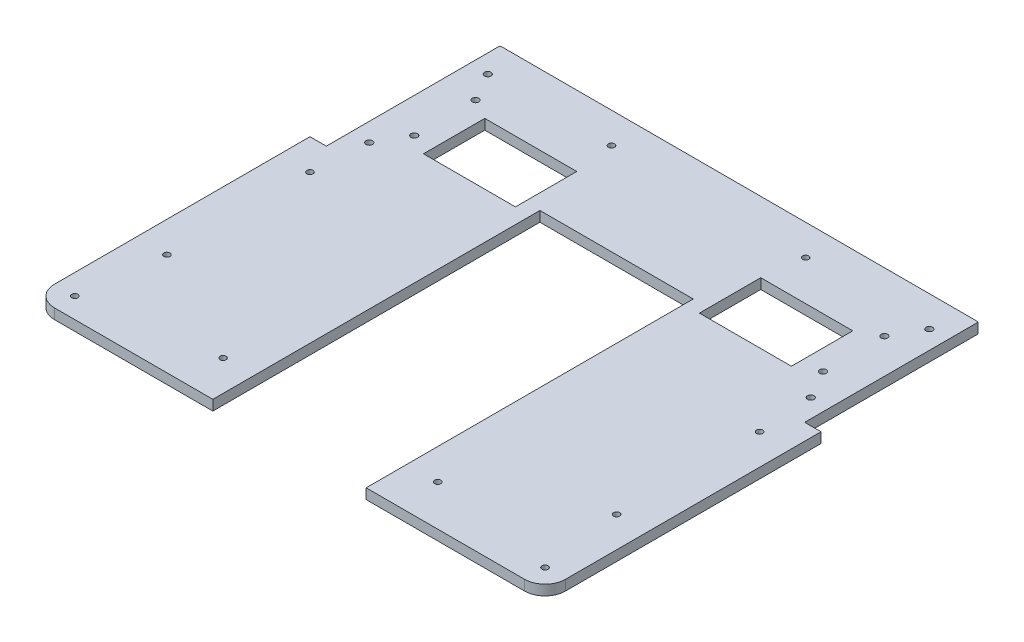
from build123d import *

# Parameters (mm, degrees)
EXTRUDE_1_DEPTH      = 5
SKETCH_4_W           = 45
SKETCH_4_H           = 30
CUT_EXTRUDE_3_DEPTH  = 5
SKETCH_5_W           = 75
SKETCH_5_H           = 160
CUT_EXTRUDE_4_DEPTH  = 5
CUT_EXTRUDE_5_REACH  = 335.054
SKETCH_6_R           = 1.5
CUT_EXTRUDE_7_REACH  = 335.054
SKETCH_7_R           = 1.6
CUT_EXTRUDE_8_REACH  = 335.054
SKETCH_8_R           = 1.5
CUT_EXTRUDE_9_REACH  = 335.054
SKETCH_9_R           = 1.5
CUT_EXTRUDE_10_REACH = 335.054
SKETCH_10_W          = 8
SKETCH_10_H          = 85


with BuildPart() as part:
    # 草图1 → 凸台-拉伸1 (new body)
    with BuildSketch(Plane(origin=(0, 0, 0), x_dir=(1, 0, 0), z_dir=(0, 1, 0))):
        with BuildLine():
            Line((10, 0), (240, 0))
            ThreePointArc((240, 0), (247.071067812, -2.928932188), (250, -10))
            Line((250, -10), (250, -210))
            ThreePointArc((250, -210), (247.071067812, -217.071067812), (240, -220))
            Line((240, -220), (10, -220))
            ThreePointArc((10, -220), (2.928932188, -217.071067812), (0, -210))
            Line((0, -210), (0, -10))
            ThreePointArc((0, -10), (2.928932188, -2.928932188), (10, 0))
        make_face()
    extrude(amount=EXTRUDE_1_DEPTH)

    # 草图4 → 切除-拉伸3 (cut)
    with BuildSketch(Plane.XZ):
        with Locations((192.5, 49.475)):
            Rectangle(SKETCH_4_W, SKETCH_4_H)
        with Locations((57.5, 49.475)):
            Rectangle(SKETCH_4_W, SKETCH_4_H)
    extrude(amount=-CUT_EXTRUDE_3_DEPTH, mode=Mode.SUBTRACT)

    # 草图5 → 切除-拉伸4 (cut)
    with BuildSketch(Plane.XZ):
        with Locations((125, 140)):
            Rectangle(SKETCH_5_W, SKETCH_5_H)
    extrude(amount=-CUT_EXTRUDE_4_DEPTH, mode=Mode.SUBTRACT)

    # 草图6 → 切除-拉伸5 (cut, up to next)
    with BuildSketch(Plane.XZ, mode=Mode.PRIVATE) as cut_extrude_5_sk1:
        with Locations(Location((72.5, 200, 0), (0, 0, 270))):
            Circle(SKETCH_6_R)
    cut_extrude_5_tool1 = extrude(cut_extrude_5_sk1.sketch, amount=-CUT_EXTRUDE_5_REACH, mode=Mode.PRIVATE) & part.part
    # 草图6 → 切除-拉伸5 (cut, up to next)
    with BuildSketch(Plane.XZ, mode=Mode.PRIVATE) as cut_extrude_5_sk2:
        with Locations(Location((177.5, 200, 0), (0, 0, 90))):
            Circle(SKETCH_6_R)
    cut_extrude_5_tool2 = extrude(cut_extrude_5_sk2.sketch, amount=-CUT_EXTRUDE_5_REACH, mode=Mode.PRIVATE) & part.part
    add(cut_extrude_5_tool1.solids().sort_by_distance((72.5, 0, 200))[0], mode=Mode.SUBTRACT)
    add(cut_extrude_5_tool2.solids().sort_by_distance((177.5, 0, 200))[0], mode=Mode.SUBTRACT)

    # 草图7 → 切除-拉伸7 (cut, up to next)
    with BuildSketch(Plane.XZ, mode=Mode.PRIVATE) as cut_extrude_7_sk1:
        with Locations(Location((17, 15, 0), (0, 0, 270))):
            Circle(SKETCH_7_R)
    cut_extrude_7_tool1 = extrude(cut_extrude_7_sk1.sketch, amount=-CUT_EXTRUDE_7_REACH, mode=Mode.PRIVATE) & part.part
    # 草图7 → 切除-拉伸7 (cut, up to next)
    with BuildSketch(Plane.XZ, mode=Mode.PRIVATE) as cut_extrude_7_sk2:
        with Locations(Location((25, 29, 0), (0, 0, 270))):
            Circle(SKETCH_7_R)
    cut_extrude_7_tool2 = extrude(cut_extrude_7_sk2.sketch, amount=-CUT_EXTRUDE_7_REACH, mode=Mode.PRIVATE) & part.part
    # 草图7 → 切除-拉伸7 (cut, up to next)
    with BuildSketch(Plane.XZ, mode=Mode.PRIVATE) as cut_extrude_7_sk3:
        with Locations(Location((25, 59, 0), (0, 0, 270))):
            Circle(SKETCH_7_R)
    cut_extrude_7_tool3 = extrude(cut_extrude_7_sk3.sketch, amount=-CUT_EXTRUDE_7_REACH, mode=Mode.PRIVATE) & part.part
    # 草图7 → 切除-拉伸7 (cut, up to next)
    with BuildSketch(Plane.XZ, mode=Mode.PRIVATE) as cut_extrude_7_sk4:
        with Locations(Location((17, 73, 0), (0, 0, 270))):
            Circle(SKETCH_7_R)
    cut_extrude_7_tool4 = extrude(cut_extrude_7_sk4.sketch, amount=-CUT_EXTRUDE_7_REACH, mode=Mode.PRIVATE) & part.part
    # 草图7 → 切除-拉伸7 (cut, up to next)
    with BuildSketch(Plane.XZ, mode=Mode.PRIVATE) as cut_extrude_7_sk5:
        with Locations(Location((233, 73, 0), (0, 0, 90))):
            Circle(SKETCH_7_R)
    cut_extrude_7_tool5 = extrude(cut_extrude_7_sk5.sketch, amount=-CUT_EXTRUDE_7_REACH, mode=Mode.PRIVATE) & part.part
    # 草图7 → 切除-拉伸7 (cut, up to next)
    with BuildSketch(Plane.XZ, mode=Mode.PRIVATE) as cut_extrude_7_sk6:
        with Locations(Location((225, 59, 0), (0, 0, 90))):
            Circle(SKETCH_7_R)
    cut_extrude_7_tool6 = extrude(cut_extrude_7_sk6.sketch, amount=-CUT_EXTRUDE_7_REACH, mode=Mode.PRIVATE) & part.part
    # 草图7 → 切除-拉伸7 (cut, up to next)
    with BuildSketch(Plane.XZ, mode=Mode.PRIVATE) as cut_extrude_7_sk7:
        with Locations(Location((225, 29, 0), (0, 0, 90))):
            Circle(SKETCH_7_R)
    cut_extrude_7_tool7 = extrude(cut_extrude_7_sk7.sketch, amount=-CUT_EXTRUDE_7_REACH, mode=Mode.PRIVATE) & part.part
    # 草图7 → 切除-拉伸7 (cut, up to next)
    with BuildSketch(Plane.XZ, mode=Mode.PRIVATE) as cut_extrude_7_sk8:
        with Locations(Location((233, 15, 0), (0, 0, 90))):
            Circle(SKETCH_7_R)
    cut_extrude_7_tool8 = extrude(cut_extrude_7_sk8.sketch, amount=-CUT_EXTRUDE_7_REACH, mode=Mode.PRIVATE) & part.part
    add(cut_extrude_7_tool1.solids().sort_by_distance((17, 0, 15))[0], mode=Mode.SUBTRACT)
    add(cut_extrude_7_tool2.solids().sort_by_distance((25, 0, 29))[0], mode=Mode.SUBTRACT)
    add(cut_extrude_7_tool3.solids().sort_by_distance((25, 0, 59))[0], mode=Mode.SUBTRACT)
    add(cut_extrude_7_tool4.solids().sort_by_distance((17, 0, 73))[0], mode=Mode.SUBTRACT)
    add(cut_extrude_7_tool5.solids().sort_by_distance((233, 0, 73))[0], mode=Mode.SUBTRACT)
    add(cut_extrude_7_tool6.solids().sort_by_distance((225, 0, 59))[0], mode=Mode.SUBTRACT)
    add(cut_extrude_7_tool7.solids().sort_by_distance((225, 0, 29))[0], mode=Mode.SUBTRACT)
    add(cut_extrude_7_tool8.solids().sort_by_distance((233, 0, 15))[0], mode=Mode.SUBTRACT)

    # 草图8 → 切除-拉伸8 (cut, up to next)
    with BuildSketch(Plane.XZ, mode=Mode.PRIVATE) as cut_extrude_8_sk1:
        with Locations(Location((235, 170, 0), (0, 0, 270))):
            Circle(SKETCH_8_R)
    cut_extrude_8_tool1 = extrude(cut_extrude_8_sk1.sketch, amount=-CUT_EXTRUDE_8_REACH, mode=Mode.PRIVATE) & part.part
    # 草图8 → 切除-拉伸8 (cut, up to next)
    with BuildSketch(Plane.XZ, mode=Mode.PRIVATE) as cut_extrude_8_sk2:
        with Locations(Location((235, 100, 0), (0, 0, 270))):
            Circle(SKETCH_8_R)
    cut_extrude_8_tool2 = extrude(cut_extrude_8_sk2.sketch, amount=-CUT_EXTRUDE_8_REACH, mode=Mode.PRIVATE) & part.part
    # 草图8 → 切除-拉伸8 (cut, up to next)
    with BuildSketch(Plane.XZ, mode=Mode.PRIVATE) as cut_extrude_8_sk3:
        with Locations(Location((15, 100, 0), (0, 0, 90))):
            Circle(SKETCH_8_R)
    cut_extrude_8_tool3 = extrude(cut_extrude_8_sk3.sketch, amount=-CUT_EXTRUDE_8_REACH, mode=Mode.PRIVATE) & part.part
    # 草图8 → 切除-拉伸8 (cut, up to next)
    with BuildSketch(Plane.XZ, mode=Mode.PRIVATE) as cut_extrude_8_sk4:
        with Locations(Location((15, 170, 0), (0, 0, 90))):
            Circle(SKETCH_8_R)
    cut_extrude_8_tool4 = extrude(cut_extrude_8_sk4.sketch, amount=-CUT_EXTRUDE_8_REACH, mode=Mode.PRIVATE) & part.part
    add(cut_extrude_8_tool1.solids().sort_by_distance((235, 0, 170))[0], mode=Mode.SUBTRACT)
    add(cut_extrude_8_tool2.solids().sort_by_distance((235, 0, 100))[0], mode=Mode.SUBTRACT)
    add(cut_extrude_8_tool3.solids().sort_by_distance((15, 0, 100))[0], mode=Mode.SUBTRACT)
    add(cut_extrude_8_tool4.solids().sort_by_distance((15, 0, 170))[0], mode=Mode.SUBTRACT)

    # 草图9 → 切除-拉伸9 (cut, up to next)
    with BuildSketch(Plane.XZ, mode=Mode.PRIVATE) as cut_extrude_9_sk1:
        with Locations(Location((77.5, 15, 0), (0, 0, 270))):
            Circle(SKETCH_9_R)
    cut_extrude_9_tool1 = extrude(cut_extrude_9_sk1.sketch, amount=-CUT_EXTRUDE_9_REACH, mode=Mode.PRIVATE) & part.part
    # 草图9 → 切除-拉伸9 (cut, up to next)
    with BuildSketch(Plane.XZ, mode=Mode.PRIVATE) as cut_extrude_9_sk2:
        with Locations(Location((10, 210, 0), (0, 0, 270))):
            Circle(SKETCH_9_R)
    cut_extrude_9_tool2 = extrude(cut_extrude_9_sk2.sketch, amount=-CUT_EXTRUDE_9_REACH, mode=Mode.PRIVATE) & part.part
    # 草图9 → 切除-拉伸9 (cut, up to next)
    with BuildSketch(Plane.XZ, mode=Mode.PRIVATE) as cut_extrude_9_sk3:
        with Locations(Location((240, 210, 0), (0, 0, 90))):
            Circle(SKETCH_9_R)
    cut_extrude_9_tool3 = extrude(cut_extrude_9_sk3.sketch, amount=-CUT_EXTRUDE_9_REACH, mode=Mode.PRIVATE) & part.part
    # 草图9 → 切除-拉伸9 (cut, up to next)
    with BuildSketch(Plane.XZ, mode=Mode.PRIVATE) as cut_extrude_9_sk4:
        with Locations(Location((172.5, 15, 0), (0, 0, 90))):
            Circle(SKETCH_9_R)
    cut_extrude_9_tool4 = extrude(cut_extrude_9_sk4.sketch, amount=-CUT_EXTRUDE_9_REACH, mode=Mode.PRIVATE) & part.part
    add(cut_extrude_9_tool1.solids().sort_by_distance((77.5, 0, 15))[0], mode=Mode.SUBTRACT)
    add(cut_extrude_9_tool2.solids().sort_by_distance((10, 0, 210))[0], mode=Mode.SUBTRACT)
    add(cut_extrude_9_tool3.solids().sort_by_distance((240, 0, 210))[0], mode=Mode.SUBTRACT)
    add(cut_extrude_9_tool4.solids().sort_by_distance((172.5, 0, 15))[0], mode=Mode.SUBTRACT)

    # 草图10 → 切除-拉伸10 (cut, up to next)
    with BuildSketch(Plane.XZ, mode=Mode.PRIVATE) as cut_extrude_10_sk1:
        with Locations((4, 42.5)):
            Rectangle(SKETCH_10_W, SKETCH_10_H)
    cut_extrude_10_tool1 = extrude(cut_extrude_10_sk1.sketch, amount=-CUT_EXTRUDE_10_REACH, mode=Mode.PRIVATE) & part.part
    # 草图10 → 切除-拉伸10 (cut, up to next)
    with BuildSketch(Plane.XZ, mode=Mode.PRIVATE) as cut_extrude_10_sk2:
        with Locations((246, 42.5)):
            Rectangle(SKETCH_10_W, SKETCH_10_H)
    cut_extrude_10_tool2 = extrude(cut_extrude_10_sk2.sketch, amount=-CUT_EXTRUDE_10_REACH, mode=Mode.PRIVATE) & part.part
    add(cut_extrude_10_tool1.solids().sort_by_distance((4, 0, 42.5))[0], mode=Mode.SUBTRACT)
    add(cut_extrude_10_tool2.solids().sort_by_distance((246, 0, 42.5))[0], mode=Mode.SUBTRACT)


solid = part.part
